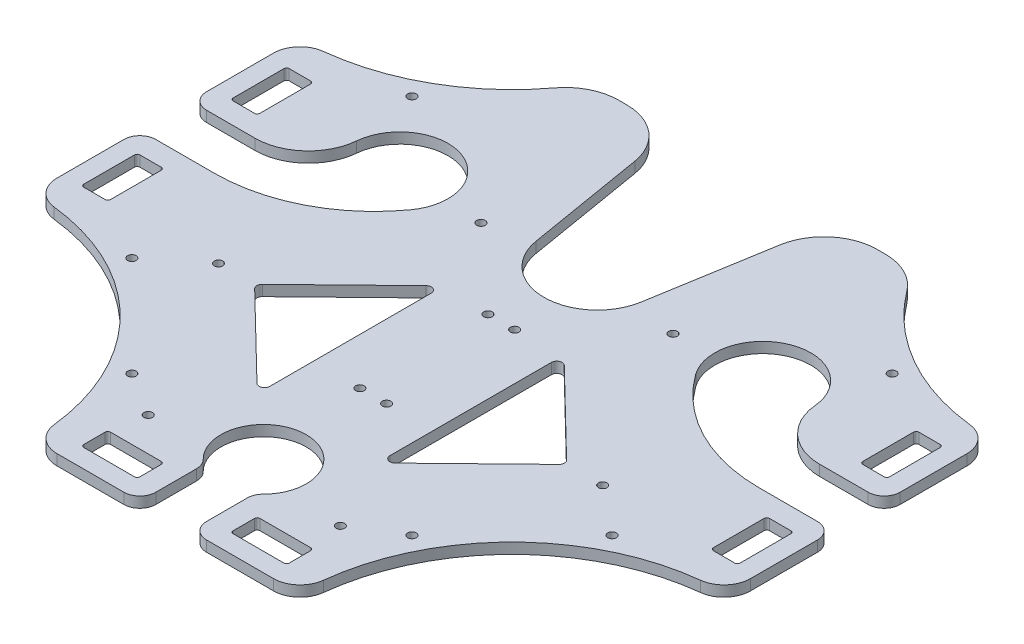
from build123d import *

# Parameters (mm, degrees)
SKETCH_1_R          = 1.6
EXTRUDE_1_DEPTH     = 2
SKETCH_2_R          = 1.6
CUT_EXTRUDE_1_DEPTH = 184.891272224
FILLET_1_R          = 10
CUT_EXTRUDE_2_DEPTH = 184.891272224
SKETCH_4_R          = 20
CUT_EXTRUDE_3_DEPTH = 184.891272224
FILLET_3_R          = 20
SKETCH_5_R          = 16
SKETCH_5_R_2        = 18
CUT_EXTRUDE_4_DEPTH = 184.891272224


with BuildPart() as part:
    # 草图1 → 凸台-拉伸1 (new, symmetric)
    with BuildSketch(Plane(origin=(0, 0, 0), x_dir=(1, 0, 0), z_dir=(0, 1, 0))):
        with BuildLine():
            ThreePointArc((-50, 130), (-73.431457505, 73.431457505), (-130, 50))
            Line((-130, 50), (-130, -50))
            ThreePointArc((-130, -50), (-73.431457505, -73.431457505), (-50, -130))
            Line((-50, -130), (50, -130))
            ThreePointArc((50, -130), (73.431457505, -73.431457505), (130, -50))
            Line((130, -50), (130, 50))
            ThreePointArc((130, 50), (73.431457505, 73.431457505), (50, 130))
            Line((50, 130), (-50, 130))
        make_face()
        with Locations(Location((-36, -100.353829072, 0), (0, 0, 270))):
            Circle(SKETCH_1_R, mode=Mode.SUBTRACT)
        with Locations(Location((-72, -38, 0), (0, 0, 270))):
            Circle(SKETCH_1_R, mode=Mode.SUBTRACT)
        with Locations(Location((-5, -52, 0), (0, 0, 270))):
            Circle(SKETCH_1_R, mode=Mode.SUBTRACT)
        with Locations(Location((-5, -4, 0), (0, 0, 270))):
            Circle(SKETCH_1_R, mode=Mode.SUBTRACT)
        with Locations(Location((36, -100.353829072, 0), (0, 0, 270))):
            Circle(SKETCH_1_R, mode=Mode.SUBTRACT)
        with Locations(Location((5, -52, 0), (0, 0, 270))):
            Circle(SKETCH_1_R, mode=Mode.SUBTRACT)
        with Locations(Location((5, -4, 0), (0, 0, 270))):
            Circle(SKETCH_1_R, mode=Mode.SUBTRACT)
        with Locations(Location((72, -38, 0), (0, 0, 270))):
            Circle(SKETCH_1_R, mode=Mode.SUBTRACT)
        with Locations(Location((-36, 24.353829072, 0), (0, 0, 270))):
            Circle(SKETCH_1_R, mode=Mode.SUBTRACT)
        with Locations(Location((36, 24.353829072, 0), (0, 0, 270))):
            Circle(SKETCH_1_R, mode=Mode.SUBTRACT)
    extrude(amount=EXTRUDE_1_DEPTH, both=True)

    # 草图2 → 切除-拉伸1 (cut, through all)
    with BuildSketch(Plane(origin=(0, 2, 0), x_dir=(1, 0, 0), z_dir=(0, 1, 0))):
        with Locations(Location((-52.5, -90, 0), (0, 0, 270))):
            Circle(SKETCH_2_R)
        with Locations(Location((52.5, -90, 0), (0, 0, 90))):
            Circle(SKETCH_2_R)
        with Locations(Location((-90, 52.5, 0), (0, 0, 270))):
            Circle(SKETCH_2_R)
        with Locations(Location((-90, -52.5, 0), (0, 0, 90))):
            Circle(SKETCH_2_R)
        with Locations(Location((90, -52.5, 0), (0, 0, 270))):
            Circle(SKETCH_2_R)
        with Locations(Location((90, 52.5, 0), (0, 0, 90))):
            Circle(SKETCH_2_R)
    extrude(amount=-CUT_EXTRUDE_1_DEPTH, mode=Mode.SUBTRACT)

    # 圆角1
    fillet_1_edges = [part.edges().sort_by_distance(p)[0] for p in [
        (50, 0, 130),
        (-50, 0, 130),
        (-130, 0, 50),
        (-130, 0, -50),
        (-50, 0, -130),
        (50, 0, -130),
        (130, 0, -50),
        (130, 0, 50),
    ]]
    fillet(fillet_1_edges, radius=FILLET_1_R)

    # 草图3 → 切除-拉伸2 (cut, through all)
    with BuildSketch(Plane(origin=(0, 2, 0), x_dir=(1, 0, 0), z_dir=(0, 1, 0))):
        with BuildLine():
            ThreePointArc((-50.4953608, 121.111111111), (-53.997738765, 105.026888717), (-60.717967697, 90))
            Line((-60.717967697, 90), (60.717967697, 90))
            ThreePointArc((60.717967697, 90), (53.997738765, 105.026888717), (50.4953608, 121.111111111))
            ThreePointArc((50.4953608, 121.111111111), (47.223947567, 127.453559925), (40.5572809, 130))
            Line((40.5572809, 130), (-40.5572809, 130))
            ThreePointArc((-40.5572809, 130), (-47.223947567, 127.453559925), (-50.4953608, 121.111111111))
        make_face()
    extrude(amount=-CUT_EXTRUDE_2_DEPTH, mode=Mode.SUBTRACT)

    # 草图4 → 切除-拉伸3 (cut, through all)
    with BuildSketch(Plane(origin=(0, 2, 0), x_dir=(1, 0, 0), z_dir=(0, 1, 0))):
        with BuildLine():
            Line((-30, 90), (-19.724871961, 28.694031744))
            ThreePointArc((-19.724871961, 28.694031744), (-1.658698401, 51.931099308), (20, 32))
            ThreePointArc((20, 32), (19.931099308, 30.341301599), (19.724871961, 28.694031744))
            Line((19.724871961, 28.694031744), (30, 90))
            Line((30, 90), (-30, 90))
        make_face()
        with Locations((0, 32)):
            Circle(SKETCH_4_R)
        with BuildLine():
            ThreePointArc((-25.894156787, -6.299874654), (-23.721640691, -5.891540745), (-22.5, -7.733864491))
            Line((-22.5, -7.733864491), (-22.5, -68.266135509))
            ThreePointArc((-22.5, -68.266135509), (-23.721640691, -70.108459255), (-25.894156787, -69.700125346))
            Line((-25.894156787, -69.700125346), (-57.025039024, -39.433989838))
            ThreePointArc((-57.025039024, -39.433989838), (-57.630882238, -38), (-57.025039024, -36.566010162))
            Line((-57.025039024, -36.566010162), (-25.894156787, -6.299874654))
        make_face()
        with BuildLine():
            ThreePointArc((22.5, -7.733864491), (23.721640691, -5.891540745), (25.894156787, -6.299874654))
            Line((25.894156787, -6.299874654), (57.025039024, -36.566010162))
            ThreePointArc((57.025039024, -36.566010162), (57.630882238, -38), (57.025039024, -39.433989838))
            Line((57.025039024, -39.433989838), (25.894156787, -69.700125346))
            ThreePointArc((25.894156787, -69.700125346), (23.721640691, -70.108459255), (22.5, -68.266135509))
            Line((22.5, -68.266135509), (22.5, -7.733864491))
        make_face()
    extrude(amount=-CUT_EXTRUDE_3_DEPTH, mode=Mode.SUBTRACT)

    # 圆角3
    fillet_3_edges = [part.edges().sort_by_distance(p)[0] for p in [
        (60.717967697, 0, -90),
        (-60.717967697, 0, -90),
        (-30, 0, -90),
        (30, 0, -90),
    ]]
    fillet(fillet_3_edges, radius=FILLET_3_R)

    # 草图5 → 切除-拉伸4 (cut, through all)
    with BuildSketch(Plane(origin=(0, 2, 0), x_dir=(1, 0, 0), z_dir=(0, 1, 0))):
        with BuildLine():
            Line((-37.5, -113), (-18.5, -113))
            ThreePointArc((-18.5, -113), (-17.792893219, -113.292893219), (-17.5, -114))
            Line((-17.5, -114), (-17.5, -122))
            ThreePointArc((-17.5, -122), (-17.792893219, -122.707106781), (-18.5, -123))
            Line((-18.5, -123), (-37.5, -123))
            ThreePointArc((-37.5, -123), (-38.207106781, -122.707106781), (-38.5, -122))
            Line((-38.5, -122), (-38.5, -114))
            ThreePointArc((-38.5, -114), (-38.207106781, -113.292893219), (-37.5, -113))
        make_face()
        with BuildLine():
            Line((-9.5, -108.738101806), (-9.5, -124))
            ThreePointArc((-9.5, -124), (-11.257359313, -128.242640687), (-15.5, -130))
            Line((-15.5, -130), (15.5, -130))
            ThreePointArc((15.5, -130), (11.257359313, -128.242640687), (9.5, -124))
            Line((9.5, -124), (9.5, -108.738101806))
            Line((9.5, -108.738101806), (9.5, -106))
            ThreePointArc((9.5, -106), (0, -109.12560681), (-9.5, -106))
            Line((-9.5, -106), (-9.5, -108.738101806))
        make_face()
        with Locations((0, -93.12560681)):
            Circle(SKETCH_5_R)
        with BuildLine():
            ThreePointArc((17.5, -114), (17.792893219, -113.292893219), (18.5, -113))
            Line((18.5, -113), (37.5, -113))
            ThreePointArc((37.5, -113), (38.207106781, -113.292893219), (38.5, -114))
            Line((38.5, -114), (38.5, -122))
            ThreePointArc((38.5, -122), (38.207106781, -122.707106781), (37.5, -123))
            Line((37.5, -123), (18.5, -123))
            ThreePointArc((18.5, -123), (17.792893219, -122.707106781), (17.5, -122))
            Line((17.5, -122), (17.5, -114))
        make_face()
        with BuildLine():
            ThreePointArc((-11.272727273, -104.480148626), (-9.960882906, -106.431983462), (-9.5, -108.738101806))
            Line((-9.5, -108.738101806), (-9.5, -106))
            ThreePointArc((-9.5, -106), (-10.414126782, -105.272456746), (-11.272727273, -104.480148626))
        make_face()
        with BuildLine():
            ThreePointArc((11.272727273, -104.480148626), (10.414126782, -105.272456746), (9.5, -106))
            Line((9.5, -106), (9.5, -108.738101806))
            ThreePointArc((9.5, -108.738101806), (9.960882906, -106.431983462), (11.272727273, -104.480148626))
        make_face()
        with BuildLine():
            Line((-113, 37.5), (-113, 18.5))
            ThreePointArc((-113, 18.5), (-113.292893219, 17.792893219), (-114, 17.5))
            Line((-114, 17.5), (-122, 17.5))
            ThreePointArc((-122, 17.5), (-122.707106781, 17.792893219), (-123, 18.5))
            Line((-123, 18.5), (-123, 37.5))
            ThreePointArc((-123, 37.5), (-122.707106781, 38.207106781), (-122, 38.5))
            Line((-122, 38.5), (-114, 38.5))
            ThreePointArc((-114, 38.5), (-113.292893219, 38.207106781), (-113, 37.5))
        make_face()
        with BuildLine():
            ThreePointArc((-114, -17.5), (-113.292893219, -17.792893219), (-113, -18.5))
            Line((-113, -18.5), (-113, -37.5))
            ThreePointArc((-113, -37.5), (-113.292893219, -38.207106781), (-114, -38.5))
            Line((-114, -38.5), (-122, -38.5))
            ThreePointArc((-122, -38.5), (-122.707106781, -38.207106781), (-123, -37.5))
            Line((-123, -37.5), (-123, -18.5))
            ThreePointArc((-123, -18.5), (-122.707106781, -17.792893219), (-122, -17.5))
            Line((-122, -17.5), (-114, -17.5))
        make_face()
        with BuildLine():
            ThreePointArc((114, 17.5), (113.292893219, 17.792893219), (113, 18.5))
            Line((113, 18.5), (113, 37.5))
            ThreePointArc((113, 37.5), (113.292893219, 38.207106781), (114, 38.5))
            Line((114, 38.5), (122, 38.5))
            ThreePointArc((122, 38.5), (122.707106781, 38.207106781), (123, 37.5))
            Line((123, 37.5), (123, 18.5))
            ThreePointArc((123, 18.5), (122.707106781, 17.792893219), (122, 17.5))
            Line((122, 17.5), (114, 17.5))
        make_face()
        with BuildLine():
            Line((113, -37.5), (113, -18.5))
            ThreePointArc((113, -18.5), (113.292893219, -17.792893219), (114, -17.5))
            Line((114, -17.5), (122, -17.5))
            ThreePointArc((122, -17.5), (122.707106781, -17.792893219), (123, -18.5))
            Line((123, -18.5), (123, -37.5))
            ThreePointArc((123, -37.5), (122.707106781, -38.207106781), (122, -38.5))
            Line((122, -38.5), (114, -38.5))
            ThreePointArc((114, -38.5), (113.292893219, -38.207106781), (113, -37.5))
        make_face()
        with BuildLine():
            Line((-105.838472485, 9.5), (-124, 9.5))
            ThreePointArc((-124, 9.5), (-128.242640687, 11.257359313), (-130, 15.5))
            Line((-130, 15.5), (-130, -15.5))
            ThreePointArc((-130, -15.5), (-128.242640687, -11.257359313), (-124, -9.5))
            Line((-124, -9.5), (-102.113780207, -9.5))
            ThreePointArc((-102.113780207, -9.5), (-74.727652332, -2.88539126), (-53.379808483, 15.5))
            ThreePointArc((-53.379808483, 15.5), (-74.29932864, 9.138254578), (-85.923486967, 27.657894737))
            ThreePointArc((-85.923486967, 27.657894737), (-92.363349207, 14.720925177), (-105.838472485, 9.5))
        make_face()
        with Locations((-68, 26)):
            Circle(SKETCH_5_R_2)
        with Locations((68, 26)):
            Circle(SKETCH_5_R_2)
        with BuildLine():
            ThreePointArc((130, 15.5), (128.242640687, 11.257359313), (124, 9.5))
            Line((124, 9.5), (105.838472485, 9.5))
            ThreePointArc((105.838472485, 9.5), (92.363349207, 14.720925177), (85.923486967, 27.657894737))
            ThreePointArc((85.923486967, 27.657894737), (85.980861567, 26.829829682), (86, 26))
            ThreePointArc((86, 26), (73.515276634, 8.865773328), (53.379808483, 15.5))
            ThreePointArc((53.379808483, 15.5), (74.727652332, -2.88539126), (102.113780207, -9.5))
            Line((102.113780207, -9.5), (124, -9.5))
            ThreePointArc((124, -9.5), (128.242640687, -11.257359313), (130, -15.5))
            Line((130, -15.5), (130, 15.5))
        make_face()
    extrude(amount=-CUT_EXTRUDE_4_DEPTH, mode=Mode.SUBTRACT)


solid = part.part
